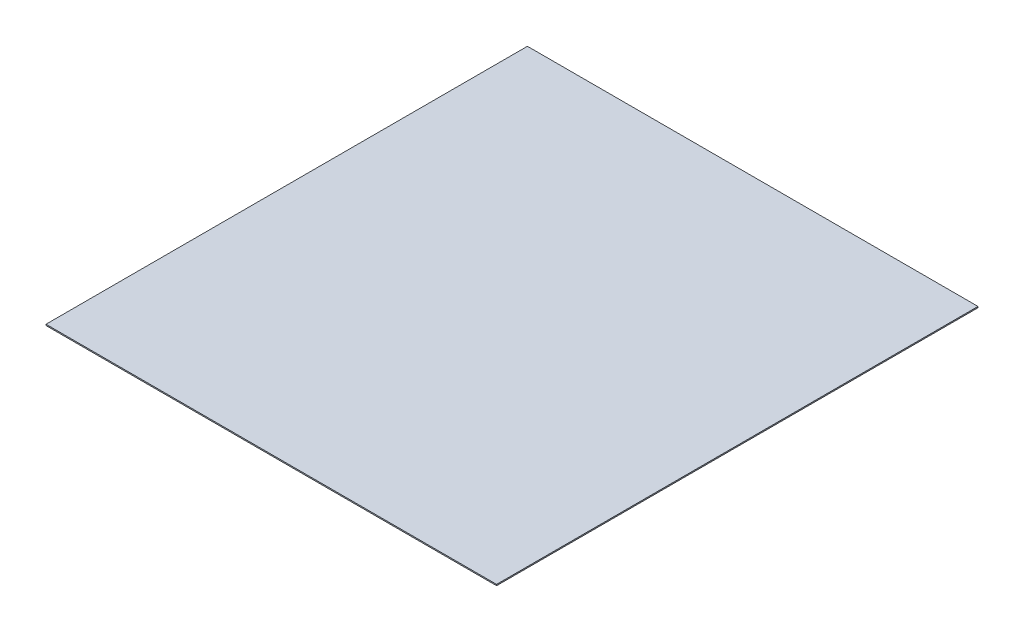
from build123d import *

# Parameters (mm, degrees)
SKETCH2_W           = 190
SKETCH2_H           = 203
BOSS_EXTRUDE2_DEPTH = 0.5


with BuildPart() as part:
    # Sketch2 → Boss-Extrude2 (new body)
    with BuildSketch(Plane(origin=(0, 0, 0), x_dir=(1, 0, 0), z_dir=(0, 1, 0))):
        Rectangle(SKETCH2_W, SKETCH2_H)
    extrude(amount=BOSS_EXTRUDE2_DEPTH)


solid = part.part
